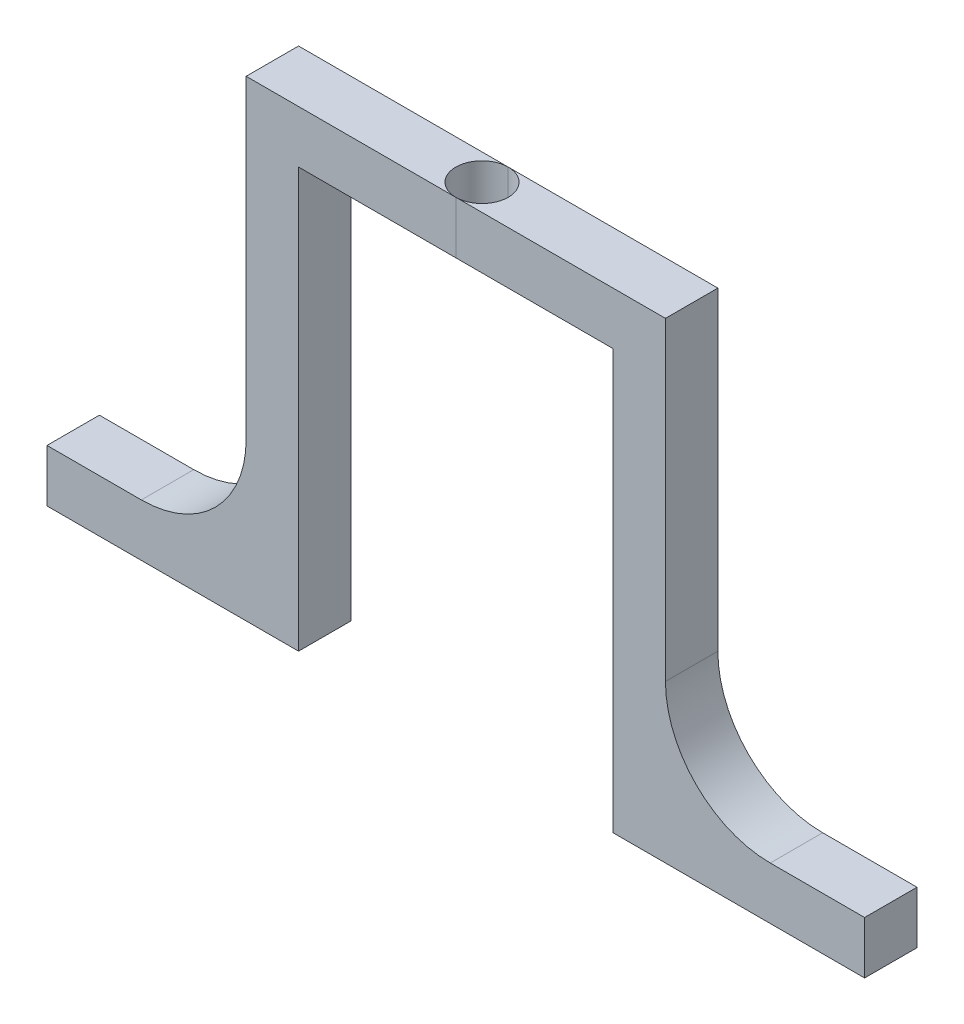
from build123d import *

# Parameters (mm, degrees)
BOSS_EXTRUDE1_DEPTH = 5
FILLET1_R           = 10
SKETCH2_R           = 2.5
CUT_EXTRUDE1_DEPTH  = 5


with BuildPart() as part:
    # Sketch1 → Boss-Extrude1 (new body)
    with BuildSketch(Plane.XY):
        Polygon((0, 0), (24, 0), (24, 40), (39, 40), (54, 40), (54, 0), (78, 0), (78, 5), (59, 5), (59, 45), (39, 45), (19, 45), (19, 5), (0, 5), align=None)
    extrude(amount=BOSS_EXTRUDE1_DEPTH)

    # Fillet1
    fillet1_edges = [part.edges().sort_by_distance(p)[0] for p in [
        (19, 5, 2.5),
        (59, 5, 2.5),
    ]]
    fillet(fillet1_edges, radius=FILLET1_R)

    # Sketch2 → Cut-Extrude1 (cut)
    with BuildSketch(Plane(origin=(0, 45, 0), x_dir=(1, 0, 0), z_dir=(0, 1, 0))):
        with Locations((39, -2.5)):
            Circle(SKETCH2_R)
    extrude(amount=-CUT_EXTRUDE1_DEPTH, mode=Mode.SUBTRACT)


with BuildPart() as cut_extrude1_piece_1:
    # of the separate pieces the step leaves, piece 1, a body of its own (cut_extrude1_pieces)
    add(part.part.solids().sort_by_distance((69, 5, 5))[0])


with BuildPart() as cut_extrude1_piece_2:
    # of the separate pieces the step leaves, piece 2, a body of its own (cut_extrude1_pieces)
    add(part.part.solids().sort_by_distance((24, 40, 5))[0])


solid = Compound([cut_extrude1_piece_1.part, cut_extrude1_piece_2.part])
